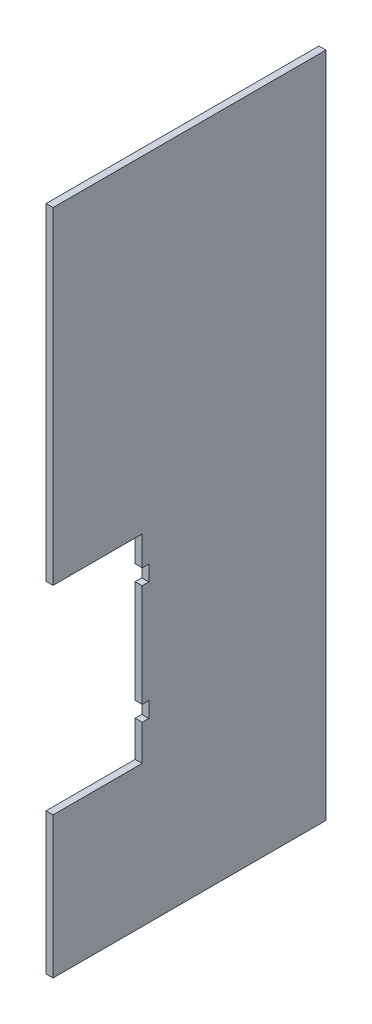
from build123d import *

# Parameters (mm, degrees)
SKETCH_1_W          = 95
SKETCH_1_H          = 38.85
EXTRUDE_1_DEPTH     = 0.5
SKETCH_2_W          = 38.85
SKETCH_2_H          = 95
EXTRUDE_2_DEPTH     = 0.5
CUT_EXTRUDE_1_DEPTH = 110.347085009


with BuildPart() as part:
    # Эскиз1 → Бобышка-Вытянуть1 (new body)
    with BuildSketch(Plane(origin=(0.5, 0, 0), x_dir=(0, -1, 0), z_dir=(-1, 0, 0))):
        with Locations((-53.35, 22.825)):
            Rectangle(SKETCH_1_W, SKETCH_1_H)
    extrude(amount=-EXTRUDE_1_DEPTH)

    # Эскиз2 → Бобышка-Вытянуть2 (add)
    with BuildSketch(Plane.ZY.offset(-0.5)):
        with Locations((22.825, 53.35)):
            Rectangle(SKETCH_2_W, SKETCH_2_H)
    extrude(amount=EXTRUDE_2_DEPTH)

    # Эскиз3 → Вырез-Вытянуть1 (cut, through all)
    with BuildSketch(Plane.ZY):
        Polygon((47.187175015, 54.261978396), (29.562288031, 54.261978396), (29.562288031, 50.078726521), (28.618889228, 50.078726521), (28.618889228, 47.878726521), (29.562288031, 47.878726521), (29.562288031, 33.238726521), (28.618889228, 33.238726521), (28.618889228, 31.038726521), (29.562288031, 31.038726521), (29.562288031, 25.969159943), (47.187175015, 25.969159943), align=None)
    extrude(amount=-CUT_EXTRUDE_1_DEPTH, mode=Mode.SUBTRACT)


solid = part.part
